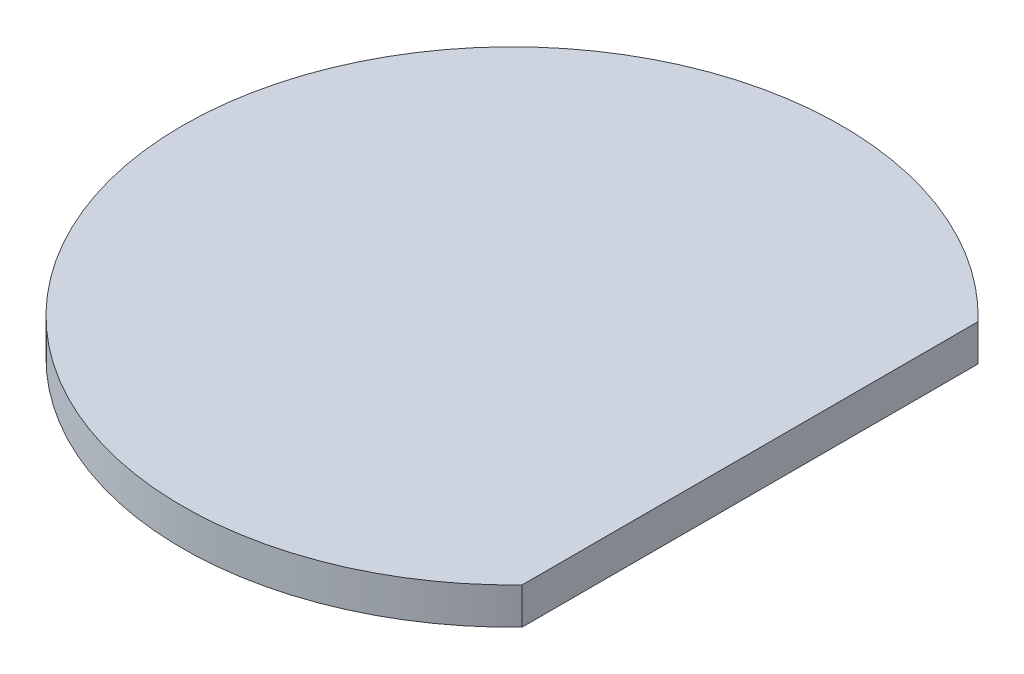
from build123d import *

# Parameters (mm, degrees)
BOSS_EXTRUDE1_DEPTH = 1


with BuildPart() as part:
    # Sketch1 → Boss-Extrude1 (new body)
    with BuildSketch(Plane(origin=(0, 0, 0), x_dir=(1, 0, 0), z_dir=(0, 1, 0))):
        with BuildLine():
            Line((6.5, -6.224949799), (6.5, 6.224949799))
            ThreePointArc((6.5, 6.224949799), (-9, 0), (6.5, -6.224949799))
        make_face()
    extrude(amount=BOSS_EXTRUDE1_DEPTH)


solid = part.part
